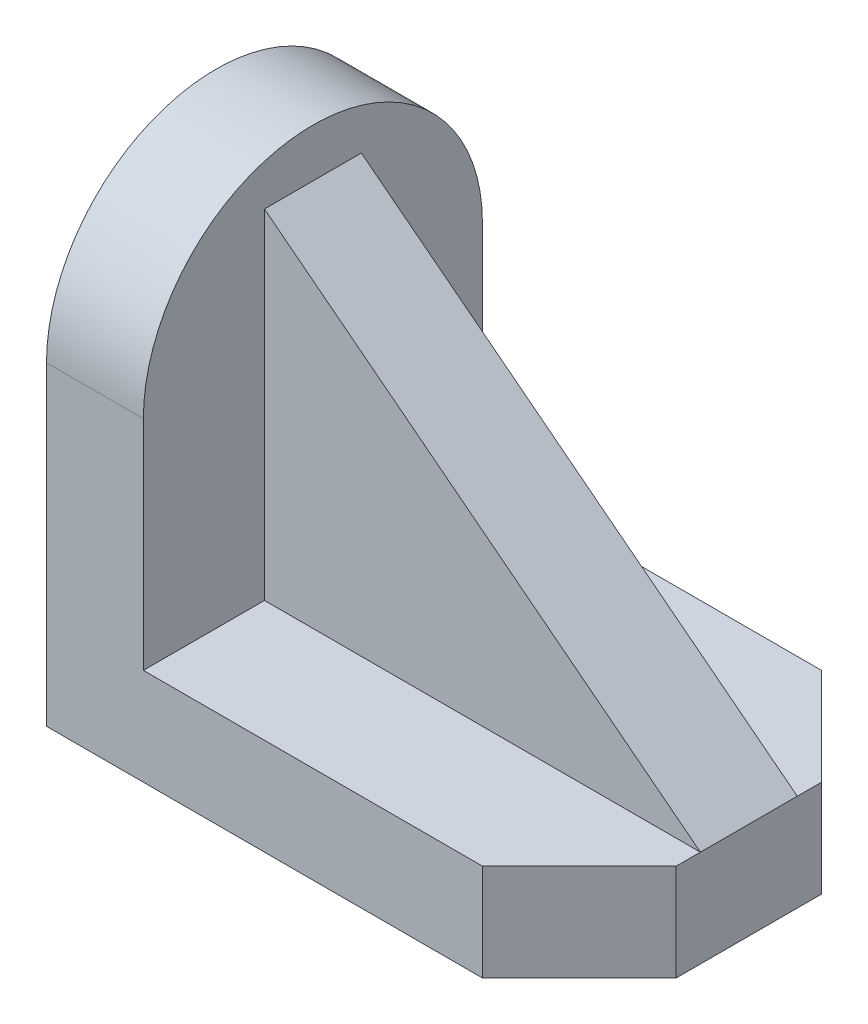
from build123d import *

# Parameters (mm, degrees)
SKETCH1_W           = 66
SKETCH1_H           = 42
BOSS_EXTRUDE1_DEPTH = 12
BOSS_EXTRUDE2_DEPTH = 12
CHAMFER3_SIZE       = 12
BOSS_EXTRUDE3_DEPTH = 6


with BuildPart() as part:
    # Sketch1 → Boss-Extrude1 (new body)
    with BuildSketch(Plane(origin=(0, 0, 0), x_dir=(1, 0, 0), z_dir=(0, 1, 0))):
        Rectangle(SKETCH1_W, SKETCH1_H)
    extrude(amount=BOSS_EXTRUDE1_DEPTH)

    # Sketch2 → Boss-Extrude2 (add)
    with BuildSketch(Plane.ZY.offset(33)):
        with BuildLine():
            Line((-21, 39), (-21, 12))
            Line((-21, 12), (21, 12))
            Line((21, 12), (21, 39))
            ThreePointArc((21, 39), (0, 18), (-21, 39))
        make_face()
        with BuildLine():
            ThreePointArc((21, 39), (0, 60), (-21, 39))
            Line((-21, 39), (21, 39))
        make_face()
        with BuildLine():
            Line((21, 39), (-21, 39))
            ThreePointArc((-21, 39), (0, 18), (21, 39))
        make_face()
        with BuildLine():
            ThreePointArc((21, 39), (0, 60), (-21, 39))
            Line((-21, 39), (21, 39))
        make_face()
        with BuildLine():
            Line((21, 39), (-21, 39))
            ThreePointArc((-21, 39), (0, 18), (21, 39))
        make_face()
    extrude(amount=-BOSS_EXTRUDE2_DEPTH)

    # Chamfer3
    chamfer3_edges = [part.edges().sort_by_distance(p)[0] for p in [
        (33, 6, 21),
        (33, 6, -21),
    ]]
    chamfer(chamfer3_edges, length=CHAMFER3_SIZE)

    # Sketch4 → Boss-Extrude3 (add, symmetric)
    with BuildSketch(Plane.XY):
        Polygon((-21, 54), (-21, 12), (33, 12), align=None)
    extrude(amount=BOSS_EXTRUDE3_DEPTH, both=True)


solid = part.part
